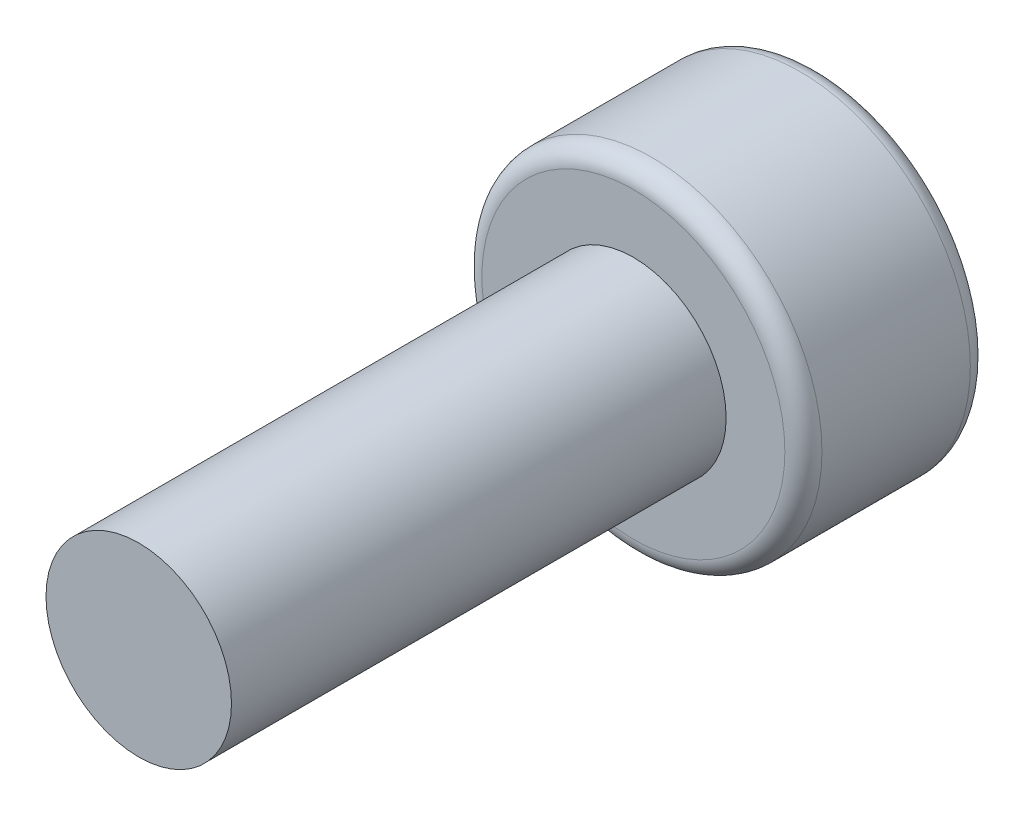
from build123d import *

# Parameters (mm, degrees)
SKETCH_1_R          = 2.75
EXTRUDE_1_DEPTH     = 3
SKETCH_2_R          = 1.5
EXTRUDE_2_DEPTH     = 8
FILLET_1_R          = 0.3
CUT_EXTRUDE_1_DEPTH = 2


with BuildPart() as part:
    # 草图1 → 凸台-拉伸1 (new body)
    with BuildSketch(Plane.XY):
        Circle(SKETCH_1_R)
    extrude(amount=EXTRUDE_1_DEPTH)

    # 草图2 → 凸台-拉伸2 (add)
    with BuildSketch(Plane.XY.offset(3)):
        Circle(SKETCH_2_R)
    extrude(amount=EXTRUDE_2_DEPTH)

    # 圆角1
    fillet_1_edges = [part.edges().sort_by_distance(p)[0] for p in [
        (-2.75, 0, 0),
        (-2.75, 0, 3),
    ]]
    fillet(fillet_1_edges, radius=FILLET_1_R)

    # 草图3 → 切除-拉伸1 (cut)
    with BuildSketch(Plane(origin=(0, 0, 0), x_dir=(-1, 0, 0), z_dir=(0, 0, -1))):
        Polygon((-0.820853493, 1.862408161), (-2.023319526, 0.220324103), (-1.202466033, -1.642084058), (0.820853493, -1.862408161), (2.023319526, -0.220324103), (1.202466033, 1.642084058), align=None)
    extrude(amount=-CUT_EXTRUDE_1_DEPTH, mode=Mode.SUBTRACT)


solid = part.part
